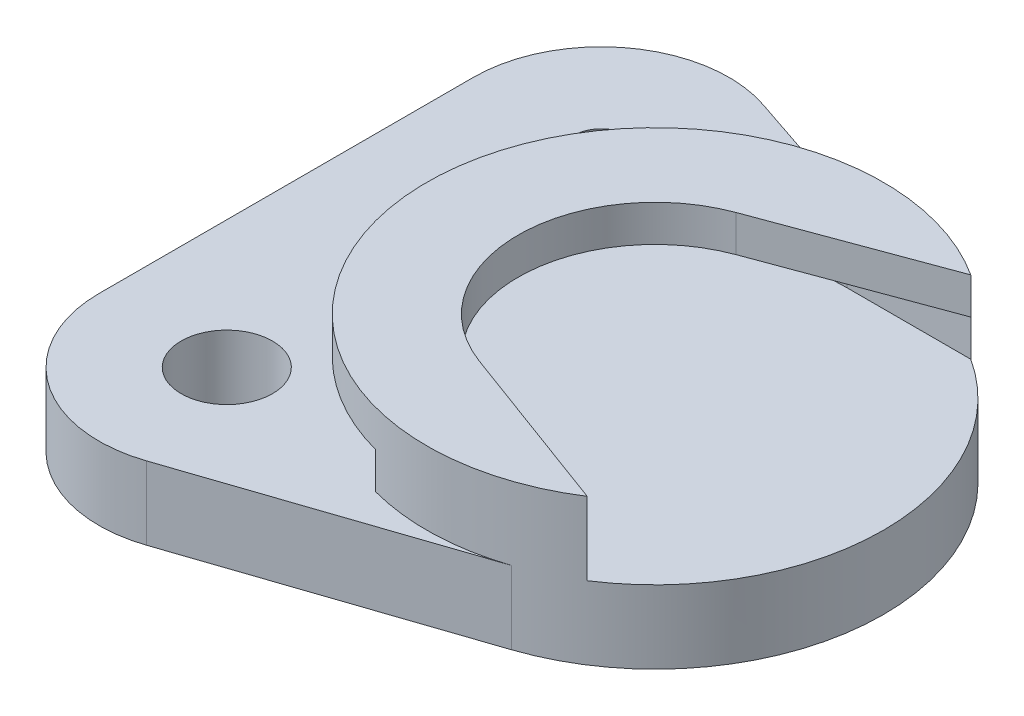
from build123d import *
from build123d.topology import SkipClean

# Parameters (mm, degrees)
SKETCH_1_R      = 12.5
EXTRUDE_1_DEPTH = 2
EXTRUDE_2_DEPTH = 2
EXTRUDE_3_DEPTH = 2
SKETCH_5_R      = 2.5
SKETCH_5_R_2    = 1.5
EXTRUDE_4_DEPTH = 2
EXTRUDE_START   = 2
SKETCH_6_R      = 1.5
SKETCH_6_R_2    = 1
SKETCH_6_R_3    = 2.5
EXTRUDE_5_DEPTH = 2


with BuildPart() as part:
    # Эскиз1 → Бобышка-Вытянуть1 (new body)
    with BuildSketch(Plane(origin=(0, 0, 0), x_dir=(1, 0, 0), z_dir=(0, 1, 0))):
        with Locations(Location((0, 0, 0), (0, 0, 270))):
            Circle(SKETCH_1_R)
    extrude(amount=EXTRUDE_1_DEPTH)

    # Эскиз2 → Бобышка-Вытянуть2 (add)
    with BuildSketch(Plane(origin=(0, 2, 0), x_dir=(1, 0, 0), z_dir=(0, 1, 0))):
        with BuildLine():
            ThreePointArc((-11.328847338, 5.282728272), (-12.203700089, 2.705495174), (-12.5, 0))
            Line((-12.5, 0), (-10.5, 0))
            ThreePointArc((-10.5, 0), (-10.251108075, 2.272615946), (-9.516231764, 4.437491748))
            Line((-9.516231764, 4.437491748), (-11.328847338, 5.282728272))
        make_face()
        with BuildLine():
            ThreePointArc((-12.5, 0), (-12.203700089, -2.705495174), (-11.328847338, -5.282728272))
            Line((-11.328847338, -5.282728272), (-9.516231764, -4.437491748))
            ThreePointArc((-9.516231764, -4.437491748), (-10.251108075, -2.272615946), (-10.5, 0))
            Line((-10.5, 0), (-12.5, 0))
        make_face()
        with BuildLine():
            Line((6.782329983, -10.5), (0, -10.5))
            ThreePointArc((0, -10.5), (-1.370525018, -10.410171044), (-2.717599974, -10.142221176))
            Line((-2.717599974, -10.142221176), (-3.235238064, -12.074072829))
            ThreePointArc((-3.235238064, -12.074072829), (1.940332855, -12.348486078), (6.782329983, -10.5))
        make_face()
        with BuildLine():
            Line((0, 10.5), (6.782329983, 10.5))
            ThreePointArc((6.782329983, 10.5), (1.940332855, 12.348486078), (-3.235238064, 12.074072829))
            Line((-3.235238064, 12.074072829), (-2.717599974, 10.142221176))
            ThreePointArc((-2.717599974, 10.142221176), (-1.370525018, 10.410171044), (0, 10.5))
        make_face()
    extrude(amount=EXTRUDE_2_DEPTH)

    # Эскиз4 → Бобышка-Вытянуть3 (add)
    with BuildSketch(Plane(origin=(0, 4, 0), x_dir=(1, 0, 0), z_dir=(0, 1, 0))):
        with BuildLine():
            ThreePointArc((-11.328847338, -5.282728272), (-3.460156945, -12.011549189), (6.782329983, -10.5))
            Line((6.782329983, -10.5), (-2.598361206, -7.035518392))
            ThreePointArc((-2.598361206, -7.035518392), (-7.5, 0), (-2.598361206, 7.035518392))
            Line((-2.598361206, 7.035518392), (6.782329983, 10.5))
            ThreePointArc((6.782329983, 10.5), (-3.460156945, 12.011549189), (-11.328847338, 5.282728272))
            Line((-11.328847338, 5.282728272), (-9.516231764, 4.437491748))
            ThreePointArc((-9.516231764, 4.437491748), (-10.5, 0), (-9.516231764, -4.437491748))
            Line((-9.516231764, -4.437491748), (-11.328847338, -5.282728272))
        make_face()
        with BuildLine():
            Line((-9.516231764, 4.437491748), (-11.328847338, 5.282728272))
            ThreePointArc((-11.328847338, 5.282728272), (-12.5, 0), (-11.328847338, -5.282728272))
            Line((-11.328847338, -5.282728272), (-9.516231764, -4.437491748))
            ThreePointArc((-9.516231764, -4.437491748), (-10.5, 0), (-9.516231764, 4.437491748))
        make_face()
    extrude(amount=EXTRUDE_3_DEPTH)

    # Эскиз5 → Бобышка-Вытянуть4 (add)
    with BuildSketch(Plane.XZ):
        with BuildLine():
            Line((-20.2, 10.25), (-20.2, -10.25))
            ThreePointArc((-20.2, -10.25), (-17.284002551, -15.935149353), (-10.965450526, -16.883761274))
            Line((-10.965450526, -16.883761274), (3.990266919, -11.846002276))
            ThreePointArc((3.990266919, -11.846002276), (12.5, 0), (3.990266919, 11.846002276))
            Line((3.990266919, 11.846002276), (-10.965450526, 16.883761274))
            ThreePointArc((-10.965450526, 16.883761274), (-17.284002551, 15.935149353), (-20.2, 10.25))
        make_face()
        with Locations(Location((-13.2, 10.25, 0), (0, 0, 270))):
            Circle(SKETCH_5_R, mode=Mode.SUBTRACT)
        with Locations(Location((-13.2, -10.25, 0), (0, 0, 270))):
            Circle(SKETCH_5_R_2, mode=Mode.SUBTRACT)
    extrude(amount=-EXTRUDE_4_DEPTH)

    # Эскиз6 → Бобышка-Вытянуть5 (add)
    with SkipClean():  # the faces are left unmerged after this step: merging them gives an invalid solid
        with BuildSketch(Plane.XZ.offset(EXTRUDE_START)):
            with BuildLine():
                Line((3.990266919, 11.846002276), (-10.965450526, 16.883761274))
                ThreePointArc((-10.965450526, 16.883761274), (-17.284002551, 15.935149353), (-20.2, 10.25))
                Line((-20.2, 10.25), (-20.2, -10.25))
                ThreePointArc((-20.2, -10.25), (-17.284002551, -15.935149353), (-10.965450526, -16.883761274))
                Line((-10.965450526, -16.883761274), (3.990266919, -11.846002276))
                ThreePointArc((3.990266919, -11.846002276), (12.5, 0), (3.990266919, 11.846002276))
            make_face()
            with Locations(Location((-13.2, -10.25, 0), (0, 0, 270))):
                Circle(SKETCH_6_R, mode=Mode.SUBTRACT)
            with Locations(Location((-8.2, 10.25, 0), (0, 0, 270))):
                Circle(SKETCH_6_R_2, mode=Mode.SUBTRACT)
            with Locations(Location((-13.2, 5.25, 0), (0, 0, 270))):
                Circle(SKETCH_6_R_2, mode=Mode.SUBTRACT)
            with Locations(Location((-18.2, 10.25, 0), (0, 0, 270))):
                Circle(SKETCH_6_R_2, mode=Mode.SUBTRACT)
            with Locations(Location((-13.2, 15.25, 0), (0, 0, 270))):
                Circle(SKETCH_6_R_2, mode=Mode.SUBTRACT)
            with Locations(Location((-13.2, 10.25, 0), (0, 0, 270))):
                Circle(SKETCH_6_R_3, mode=Mode.SUBTRACT)
        extrude(amount=-EXTRUDE_5_DEPTH)


solid = part.part
